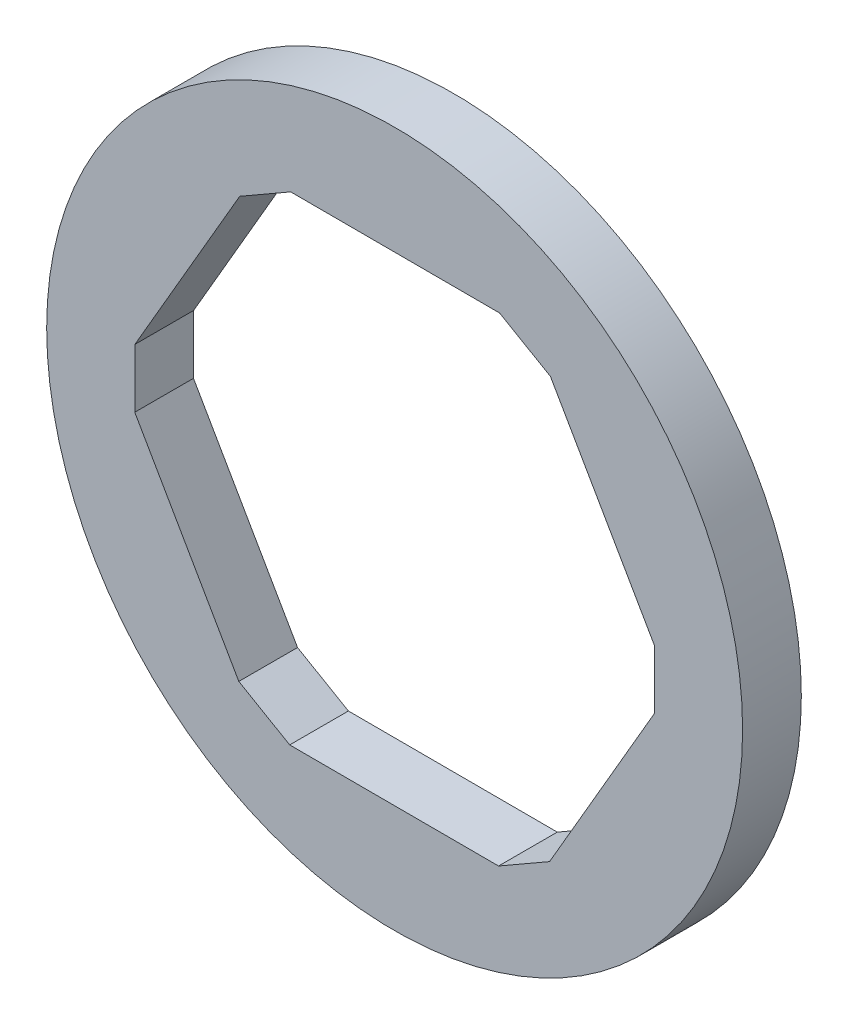
from build123d import *

# Parameters (mm, degrees)
SKETCH1_R           = 9.266757501
BOSS_EXTRUDE1_DEPTH = 1.563624


with BuildPart() as part:
    # Sketch1 → Boss-Extrude1 (new body)
    with BuildSketch(Plane.XY):
        Circle(SKETCH1_R)
        Polygon((-2.767409235, 6.38944281), (-4.125640066, 5.60915567), (-6.917124407, 0.798074705), (-6.920491338, -0.768331269), (-4.149715172, -5.591368105), (-2.794851271, -6.377486939), (2.767409235, -6.38944281), (4.125640066, -5.60915567), (6.917124407, -0.798074705), (6.920491338, 0.768331269), (4.149715172, 5.591368105), (2.794851271, 6.377486939), align=None, mode=Mode.SUBTRACT)
    extrude(amount=BOSS_EXTRUDE1_DEPTH)


solid = part.part
